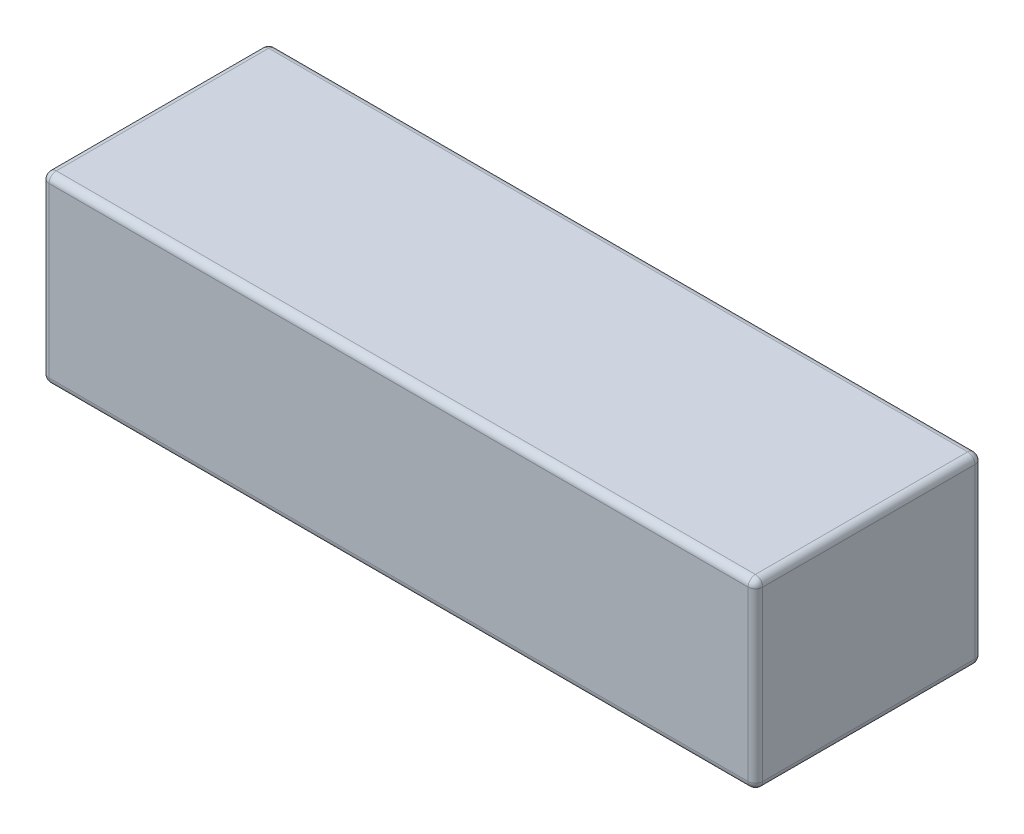
from build123d import *

# Parameters (mm, degrees)
SKETCH1_W           = 247.65
SKETCH1_H           = 78.74
BOSS_EXTRUDE1_DEPTH = 63.5
FILLET1_R           = 2.54


with BuildPart() as part:
    # Sketch1 → Boss-Extrude1 (new body)
    with BuildSketch(Plane(origin=(0, 0, 0), x_dir=(1, 0, 0), z_dir=(0, 1, 0))):
        Rectangle(SKETCH1_W, SKETCH1_H)
    extrude(amount=BOSS_EXTRUDE1_DEPTH)

    # Fillet1
    fillet1_edges = [part.edges().sort_by_distance(p)[0] for p in [
        (123.825, 63.5, 0),
        (0, 63.5, -39.37),
        (-123.825, 63.5, 0),
        (0, 0, -39.37),
        (123.825, 0, 0),
        (0, 0, 39.37),
        (-123.825, 0, 0),
        (-123.825, 31.75, -39.37),
        (123.825, 31.75, -39.37),
        (123.825, 31.75, 39.37),
        (-123.825, 31.75, 39.37),
        (0, 63.5, 39.37),
    ]]
    fillet(fillet1_edges, radius=FILLET1_R)


solid = part.part
